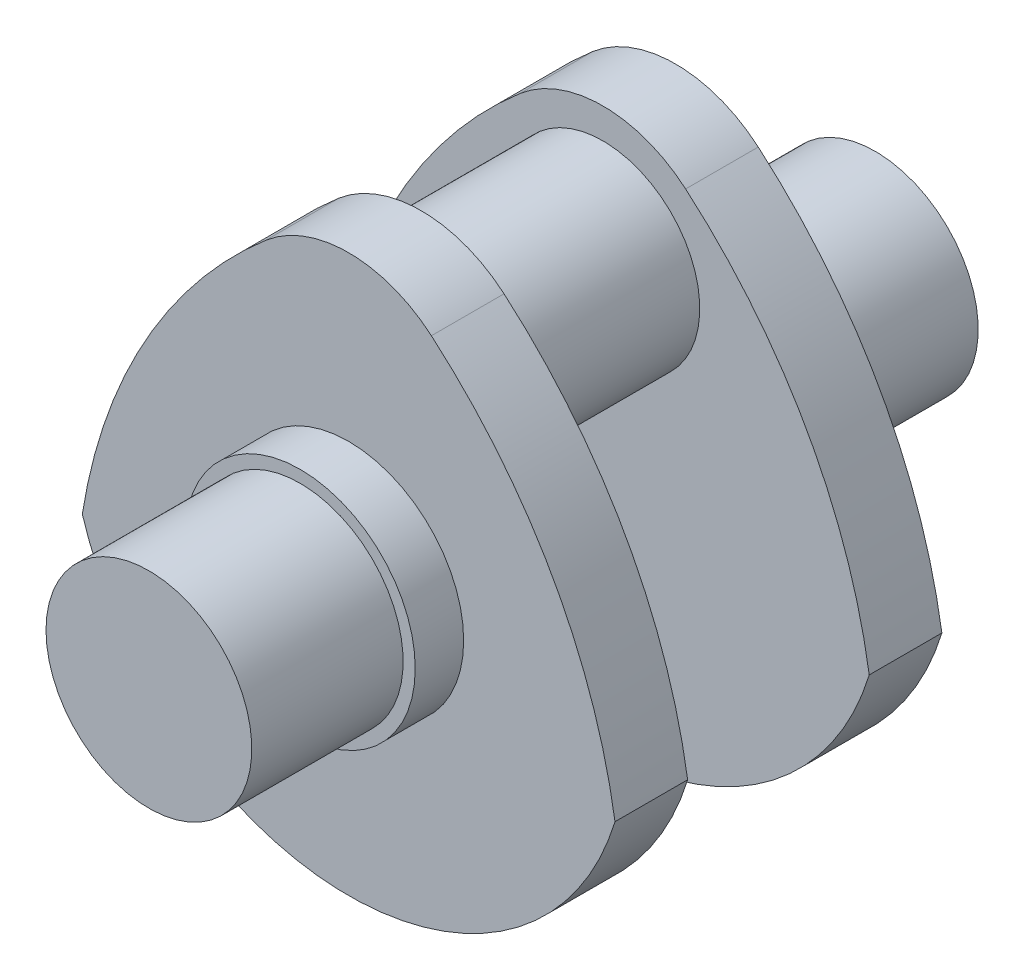
from build123d import *

# Parameters (mm, degrees)
SKETCH1_R           = 431.8
BOSS_EXTRUDE1_DEPTH = 635
SKETCH2_R           = 482.6
BOSS_EXTRUDE2_DEPTH = 203.2
BOSS_EXTRUDE3_DEPTH = 304.8
SKETCH7_R           = 406.4
BOSS_EXTRUDE4_DEPTH = 381


with BuildPart() as part:
    # Sketch1 → Boss-Extrude1 (new body)
    with BuildSketch(Plane.XY):
        with Locations(Location((0, 0, 0), (0, 0, 180))):
            Circle(SKETCH1_R)
    extrude(amount=BOSS_EXTRUDE1_DEPTH)

    # Sketch2 → Boss-Extrude2 (add)
    with BuildSketch(Plane.XY):
        Circle(SKETCH2_R)
    extrude(amount=-BOSS_EXTRUDE2_DEPTH)

    # Sketch6 → Boss-Extrude3 (add)
    with BuildSketch(Plane(origin=(0, 0, -203.2), x_dir=(-1, 0, 0), z_dir=(0, 0, -1))):
        with BuildLine():
            ThreePointArc((-1117.6, -340.776759771), (0, -1168.4), (1117.6, -340.776759771))
            ThreePointArc((1117.6, -340.776759771), (855.559483917, 418.319143644), (347.169606843, 1039.955335913))
            ThreePointArc((347.169606843, 1039.955335913), (0, 1168.4), (-347.169606843, 1039.955335913))
            ThreePointArc((-347.169606843, 1039.955335913), (-855.559483917, 418.319143644), (-1117.6, -340.776759771))
        make_face()
    extrude(amount=BOSS_EXTRUDE3_DEPTH)

    # Sketch7 → Boss-Extrude4 (add)
    with BuildSketch(Plane(origin=(0, 0, -508), x_dir=(-1, 0, 0), z_dir=(0, 0, -1))):
        with Locations((0, 635)):
            Circle(SKETCH7_R)
    extrude(amount=BOSS_EXTRUDE4_DEPTH)

    # Mirror1: part across plane


with BuildPart() as part_1:
    add(part.part)
    add(part.part.mirror(Plane(origin=(0, 635, -889), x_dir=(1, 0, 0), z_dir=(0, 0, -1))))


solid = part_1.part
